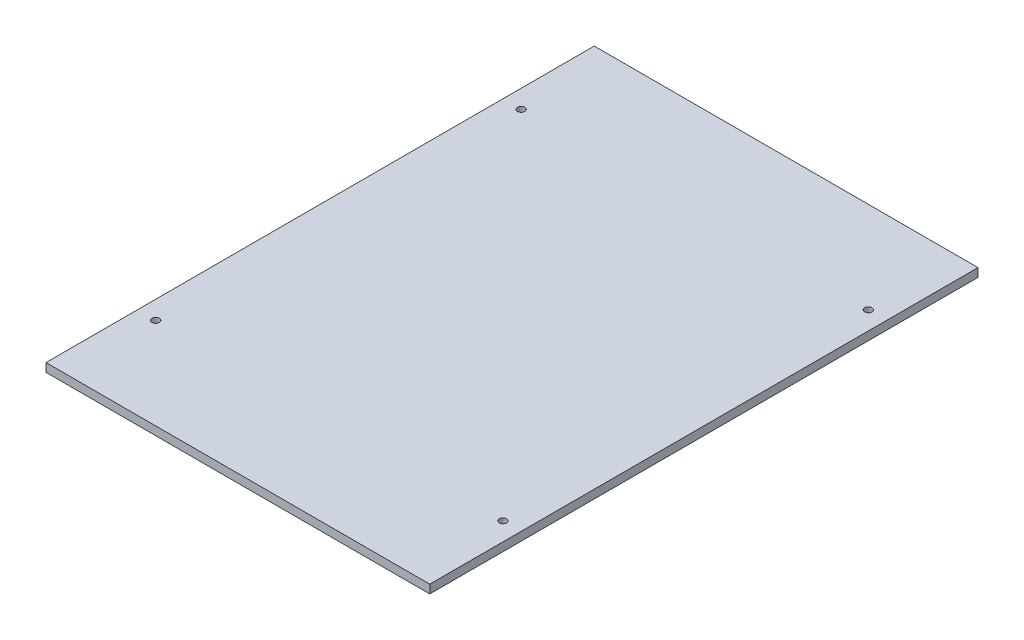
from build123d import *

# Parameters (mm, degrees)
SKETCH_1_W      = 210
SKETCH_1_H      = 300
EXTRUDE_1_DEPTH = 4.65
MM_1_D          = 4


with BuildPart() as part:
    # 草图1 → 凸台-拉伸1 (new body)
    with BuildSketch(Plane(origin=(0, 0, 0), x_dir=(1, 0, 0), z_dir=(0, 1, 0))):
        with Locations((105, 150)):
            Rectangle(SKETCH_1_W, SKETCH_1_H)
    extrude(amount=EXTRUDE_1_DEPTH)

    # 大小mm 暗销孔1 (through all)
    with Locations(Plane(origin=(0, 4.65, 0), x_dir=(1, 0, 0), z_dir=(0, 1, 0))):
        with Locations((10, 250), (10, 50), (200, 250), (200, 50)):
            Hole(MM_1_D / 2)


solid = part.part
